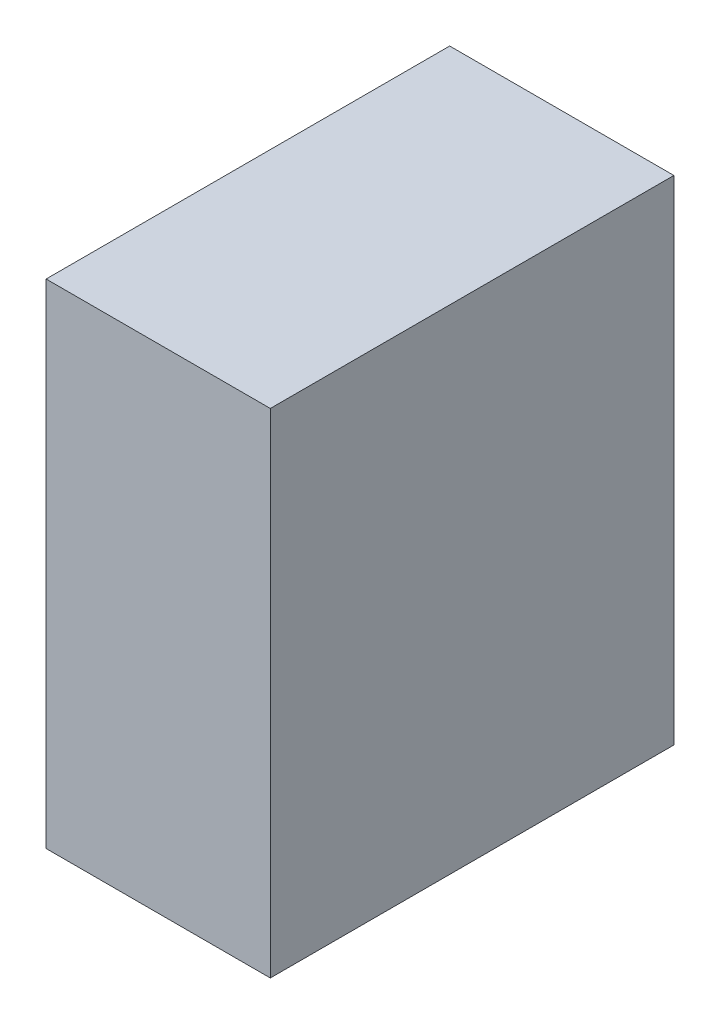
from build123d import *

# Parameters (mm, degrees)
SKETCH1_W           = 90
SKETCH1_H           = 110
BOSS_EXTRUDE1_DEPTH = 25


with BuildPart() as part:
    # Sketch1 → Boss-Extrude1 (new, symmetric)
    with BuildSketch(Plane(origin=(0, 0, 0), x_dir=(0, 0, -1), z_dir=(1, 0, 0))):
        with Locations((45, 55)):
            Rectangle(SKETCH1_W, SKETCH1_H)
    extrude(amount=BOSS_EXTRUDE1_DEPTH, both=True)


solid = part.part
